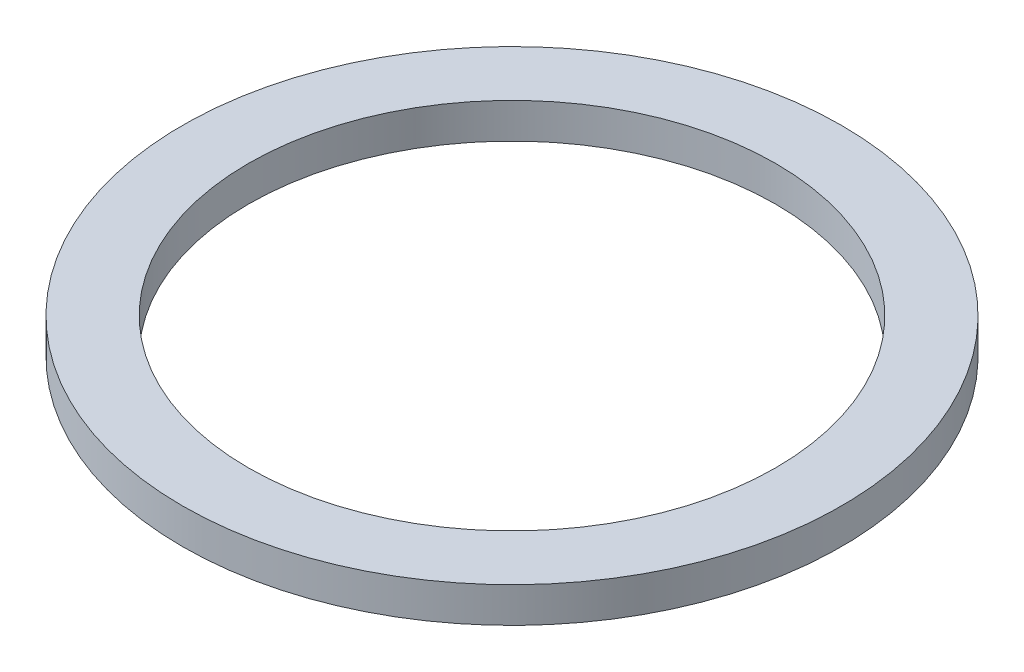
from build123d import *

# Parameters (mm, degrees)
SKETCH1_R           = 50
SKETCH1_R_2         = 40
BOSS_EXTRUDE1_DEPTH = 5.3522


with BuildPart() as part:
    # Sketch1 → Boss-Extrude1 (new body)
    with BuildSketch(Plane(origin=(0, 0, 0), x_dir=(1, 0, 0), z_dir=(0, 1, 0))):
        with Locations(Location((0, 0, 0), (0, 0, 270))):
            Circle(SKETCH1_R)
        with Locations(Location((0, 0, 0), (0, 0, 270))):
            Circle(SKETCH1_R_2, mode=Mode.SUBTRACT)
    extrude(amount=BOSS_EXTRUDE1_DEPTH)


solid = part.part
